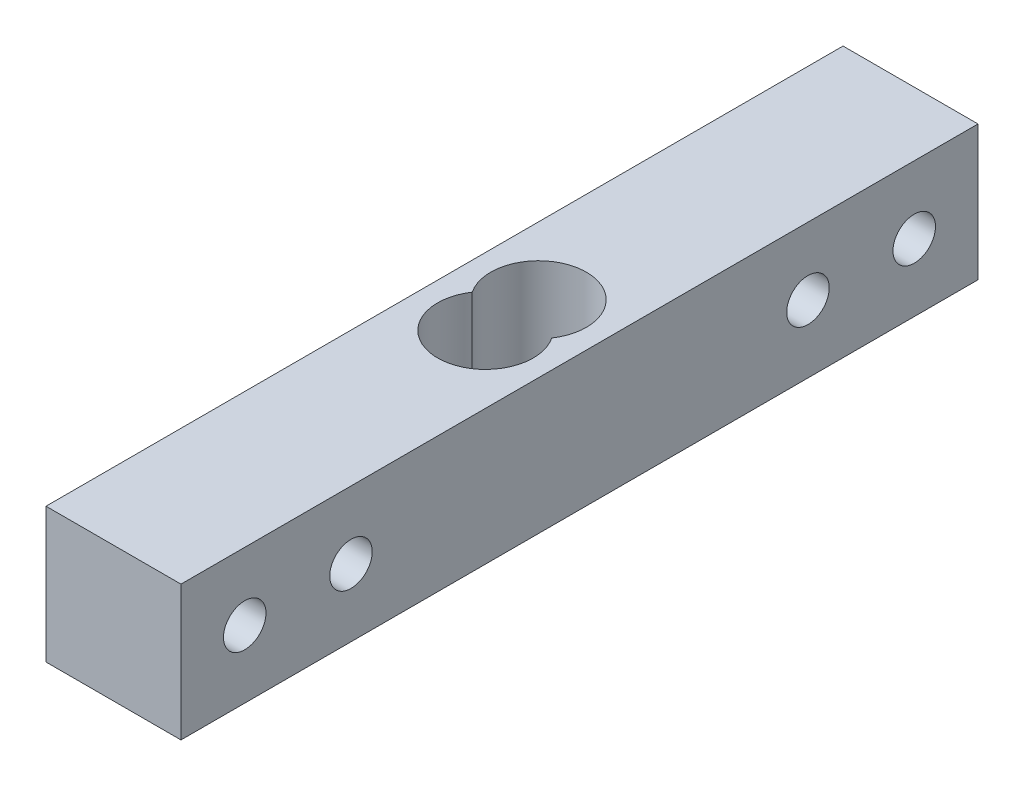
from build123d import *

# Parameters (mm, degrees)
SKETCH1_W           = 12.7
SKETCH1_H           = 12.7
BOSS_EXTRUDE1_DEPTH = 37.5
SKETCH2_R           = 2
CUT_EXTRUDE1_DEPTH  = 80
CUT_EXTRUDE2_DEPTH  = 80


with BuildPart() as part:
    # Sketch1 → Boss-Extrude1 (new, symmetric)
    with BuildSketch(Plane.XY):
        Rectangle(SKETCH1_W, SKETCH1_H)
    extrude(amount=BOSS_EXTRUDE1_DEPTH, both=True)

    # Sketch2 → Cut-Extrude1 (cut)
    with BuildSketch(Plane(origin=(6.35, 0, 0), x_dir=(0, 0, -1), z_dir=(1, 0, 0))):
        with Locations((-31.5, 0)):
            Circle(SKETCH2_R)
        with Locations((-21.5, 0)):
            Circle(SKETCH2_R)
        with Locations((21.5, 0)):
            Circle(SKETCH2_R)
        with Locations((31.5, 0)):
            Circle(SKETCH2_R)
    extrude(amount=-CUT_EXTRUDE1_DEPTH, mode=Mode.SUBTRACT)

    # Sketch3 → Cut-Extrude2 (cut)
    with BuildSketch(Plane.XZ.offset(6.35)):
        with BuildLine():
            ThreePointArc((3.741657387, 0), (0, 7), (-3.741657387, 0))
            ThreePointArc((-3.741657387, 0), (0, -7), (3.741657387, 0))
        make_face()
    extrude(amount=-CUT_EXTRUDE2_DEPTH, mode=Mode.SUBTRACT)


solid = part.part
